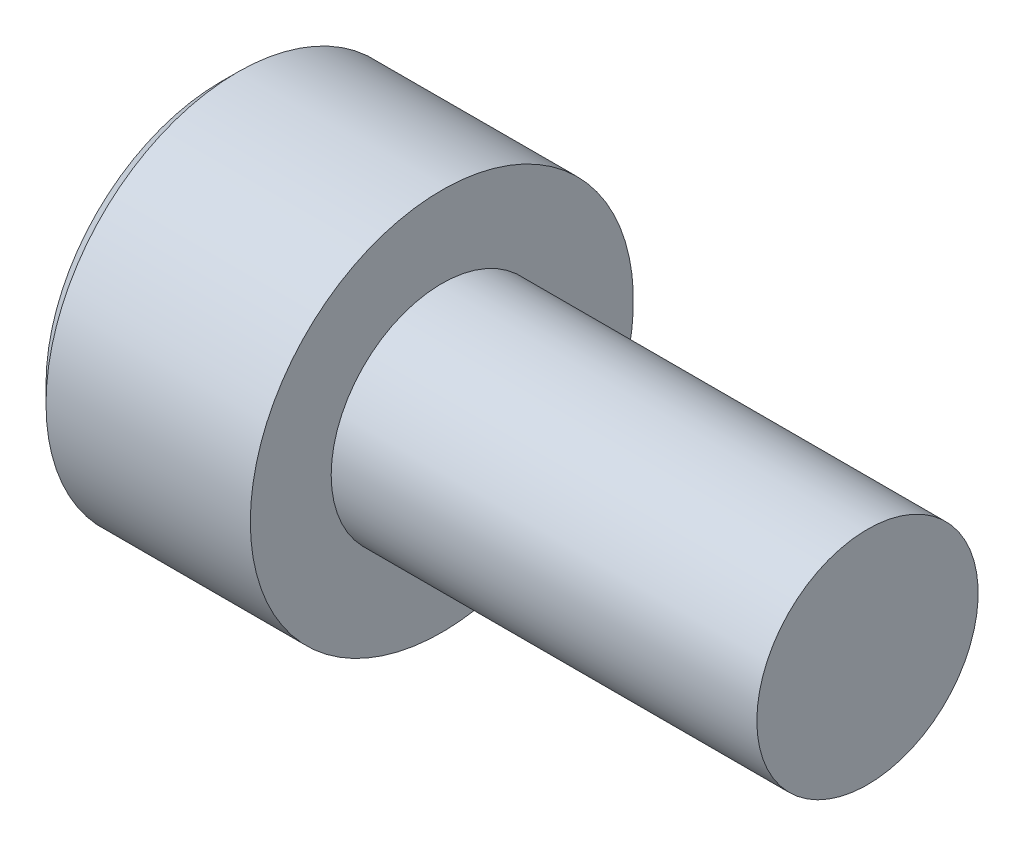
from build123d import *

# Parameters (mm, degrees)
CHAMFER1_SIZE      = 0.2
CUT_EXTRUDE1_DEPTH = 1.1


with BuildPart() as part:
    # Sketch1 → Revolve1 (revolve)
    with BuildSketch(Plane.XY, mode=Mode.PRIVATE) as revolve1_sk:
        Polygon((-2.6, 0), (5, 0), (5, 1.3), (0, 1.3), (0, 2.25), (-2.6, 2.25), align=None)
    revolve(revolve1_sk.sketch.rotate(Axis((-2.6, 0, 0), (1, 0, 0)), 90), axis=Axis((-2.6, 0, 0), (1, 0, 0)))

    # Chamfer1
    chamfer1_edges = [part.edges().sort_by_distance(p)[0] for p in [
        (-2.6, 0, -2.25),
    ]]
    chamfer(chamfer1_edges, length=CHAMFER1_SIZE)

    # Sketch2 → Cut-Revolve1 (revolve, cut)
    with BuildSketch(Plane.XY, mode=Mode.PRIVATE) as cut_revolve1_sk:
        Polygon((-0.899139381, 0), (-1.5, 1), (-2.6, 1), (-2.6, 0), align=None)
    revolve(cut_revolve1_sk.sketch.rotate(Axis((-2.6, 0, 0), (1, 0, 0)), 180), axis=Axis((-2.6, 0, 0), (1, 0, 0)), mode=Mode.SUBTRACT)

    # Sketch3 → Cut-Extrude1 (cut)
    with BuildSketch(Plane.ZY.offset(2.6)):
        Polygon((0, -1.154700538), (1, -0.577350269), (1, 0.577350269), (0, 1.154700538), (-1, 0.577350269), (-1, -0.577350269), align=None)
    extrude(amount=-CUT_EXTRUDE1_DEPTH, mode=Mode.SUBTRACT)


solid = part.part
